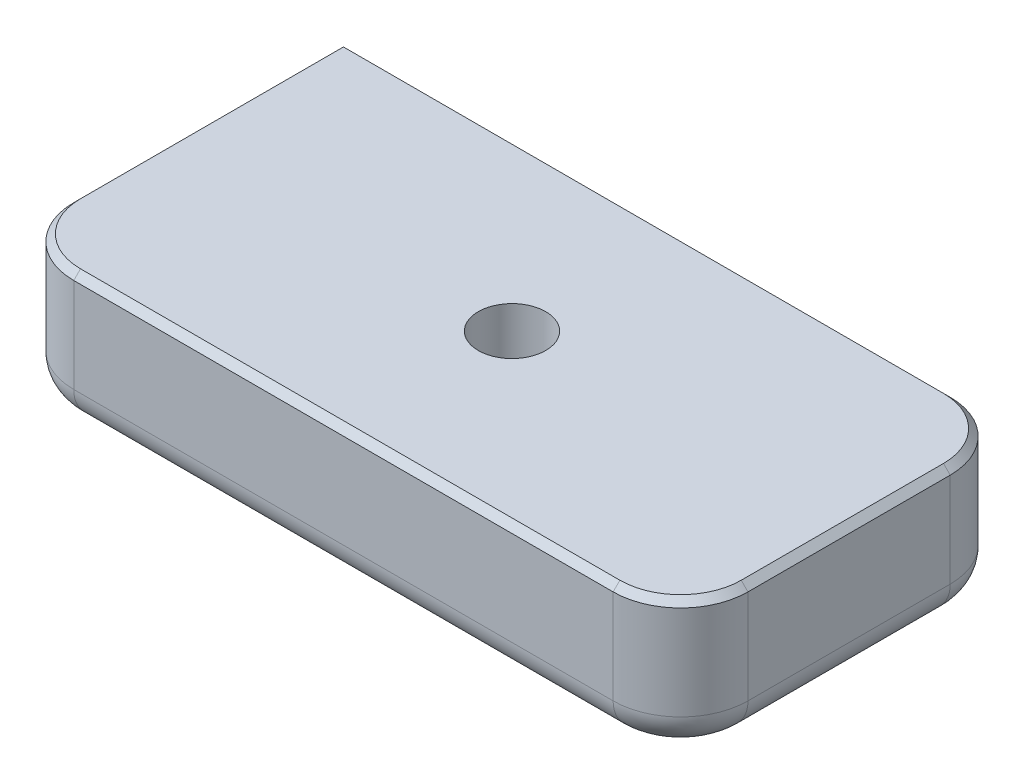
from build123d import *

# Parameters (mm, degrees)
SKETCH1_W           = 100
SKETCH1_H           = 50
BOSS_EXTRUDE1_DEPTH = 20
SKETCH2_R           = 15
CUT_EXTRUDE1_DEPTH  = 20
FILLET1_R           = 10
CHAMFER1_SIZE       = 1
MOVE_FACE1_BY       = 10
FILLET2_R           = 5


with BuildPart() as part:
    # Sketch1 → Boss-Extrude1 (new body)
    with BuildSketch(Plane(origin=(0, 0, 0), x_dir=(1, 0, 0), z_dir=(0, 1, 0))):
        Rectangle(SKETCH1_W, SKETCH1_H)
    extrude(amount=BOSS_EXTRUDE1_DEPTH)

    # Sketch2 → Cut-Extrude1 (cut)
    with BuildSketch(Plane(origin=(0, 20, 0), x_dir=(1, 0, 0), z_dir=(0, 1, 0))):
        with Locations(Location((0, 0, 0), (0, 0, 270))):
            Circle(SKETCH2_R)
    extrude(amount=-CUT_EXTRUDE1_DEPTH, mode=Mode.SUBTRACT)

    # Fillet1
    fillet1_edges = [part.edges().sort_by_distance(p)[0] for p in [
        (50, 10, 25),
        (-50, 10, 25),
        (50, 10, -25),
    ]]
    fillet(fillet1_edges, radius=FILLET1_R)

    # Chamfer1
    chamfer1_edges = [part.edges().sort_by_distance(p)[0] for p in [
        (-50, 20, -5),
        (-5, 20, -25),
        (50, 20, 0),
        (0, 20, 25),
        (-47.071067812, 20, 22.071067812),
        (47.071067812, 20, 22.071067812),
        (47.071067812, 20, -22.071067812),
    ]]
    chamfer(chamfer1_edges, length=CHAMFER1_SIZE)

    # Move Face1: a curved face moved outward by 10.0
    add(Solid.thicken(part.faces().sort_by_distance((0, 10, -15))[0], MOVE_FACE1_BY))

    # Fillet2
    fillet2_edges = [part.edges().sort_by_distance(p)[0] for p in [
        (-5, 0, -25),
        (50, 0, 0),
        (0, 0, 25),
        (-47.071067812, 0, 22.071067812),
        (47.071067812, 0, 22.071067812),
        (47.071067812, 0, -22.071067812),
        (-50, 0, -5),
    ]]
    fillet(fillet2_edges, radius=FILLET2_R)


solid = part.part
